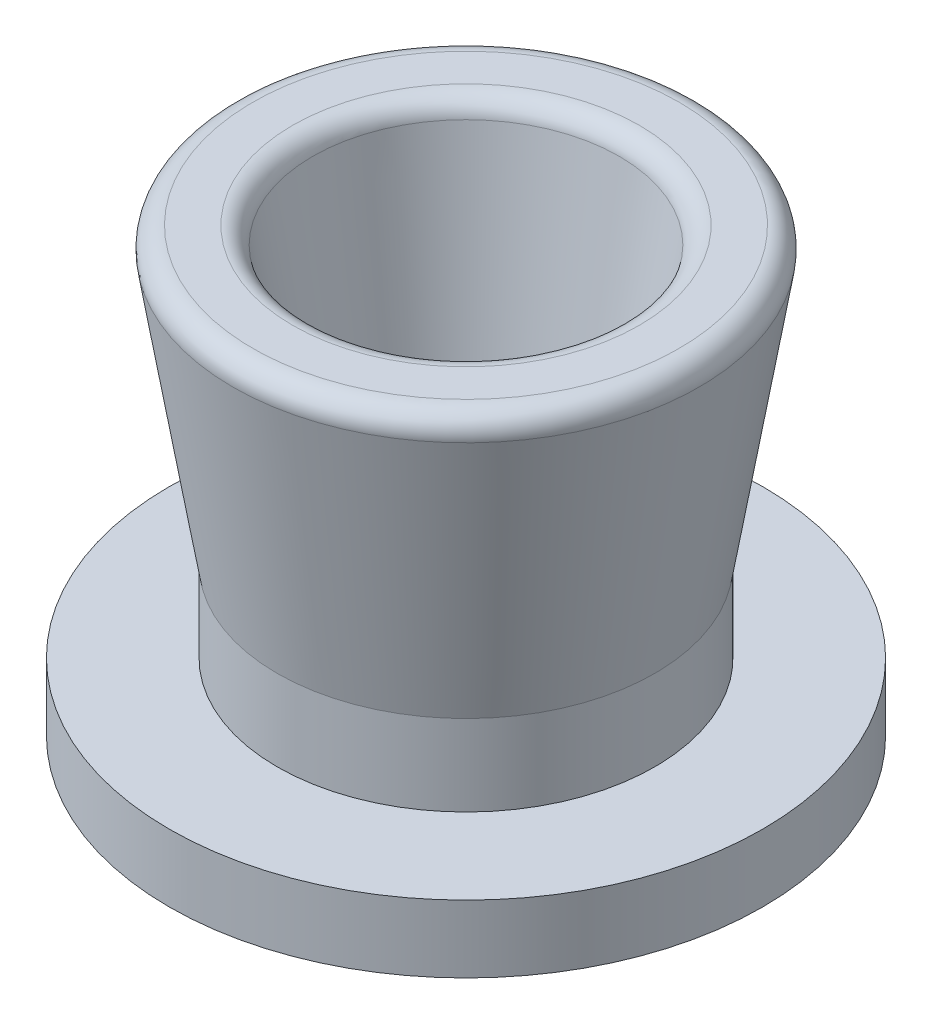
from build123d import *

# Parameters (mm, degrees)
SKETCH1_R           = 22
SKETCH1_R_2         = 8
BOSS_EXTRUDE1_DEPTH = 5
SKETCH2_R           = 14
SKETCH2_R_2         = 8
BOSS_EXTRUDE2_DEPTH = 6


with BuildPart() as part:
    # Sketch1 → Boss-Extrude1 (new body)
    with BuildSketch(Plane(origin=(0, 0, 0), x_dir=(1, 0, 0), z_dir=(0, 1, 0))):
        with Locations(Location((0, 0, 0), (0, 0, 270))):
            Circle(SKETCH1_R)
        with Locations(Location((0, 0, 0), (0, 0, 270))):
            Circle(SKETCH1_R_2, mode=Mode.SUBTRACT)
    extrude(amount=BOSS_EXTRUDE1_DEPTH)

    # Sketch2 → Boss-Extrude2 (add)
    with BuildSketch(Plane(origin=(0, 5, 0), x_dir=(1, 0, 0), z_dir=(0, 1, 0))):
        with Locations(Location((0, 0, 0), (0, 0, 270))):
            Circle(SKETCH2_R)
        with Locations(Location((0, 0, 0), (0, 0, 270))):
            Circle(SKETCH2_R_2, mode=Mode.SUBTRACT)
    extrude(amount=BOSS_EXTRUDE2_DEPTH)

    # Sketch3 → Revolve1 (revolve)
    with BuildSketch(Plane.XY, mode=Mode.PRIVATE) as revolve1_sk:
        with BuildLine():
            Line((8, 11), (11.370346923, 31.519425266))
            ThreePointArc((11.370346923, 31.519425266), (11.879606474, 32.419695227), (12.850513419, 32.776305659))
            Line((12.850513419, 32.776305659), (15.810314893, 32.776305659))
            ThreePointArc((15.810314893, 32.776305659), (16.953704462, 32.247212604), (17.29048139, 31.033186053))
            Line((17.29048139, 31.033186053), (14, 11))
            Line((14, 11), (8, 11))
        make_face()
    revolve(revolve1_sk.sketch.rotate(Axis((0, 0, 0), (0, 1, 0)), 90), axis=Axis((0, 0, 0), (0, 1, 0)))


solid = part.part
